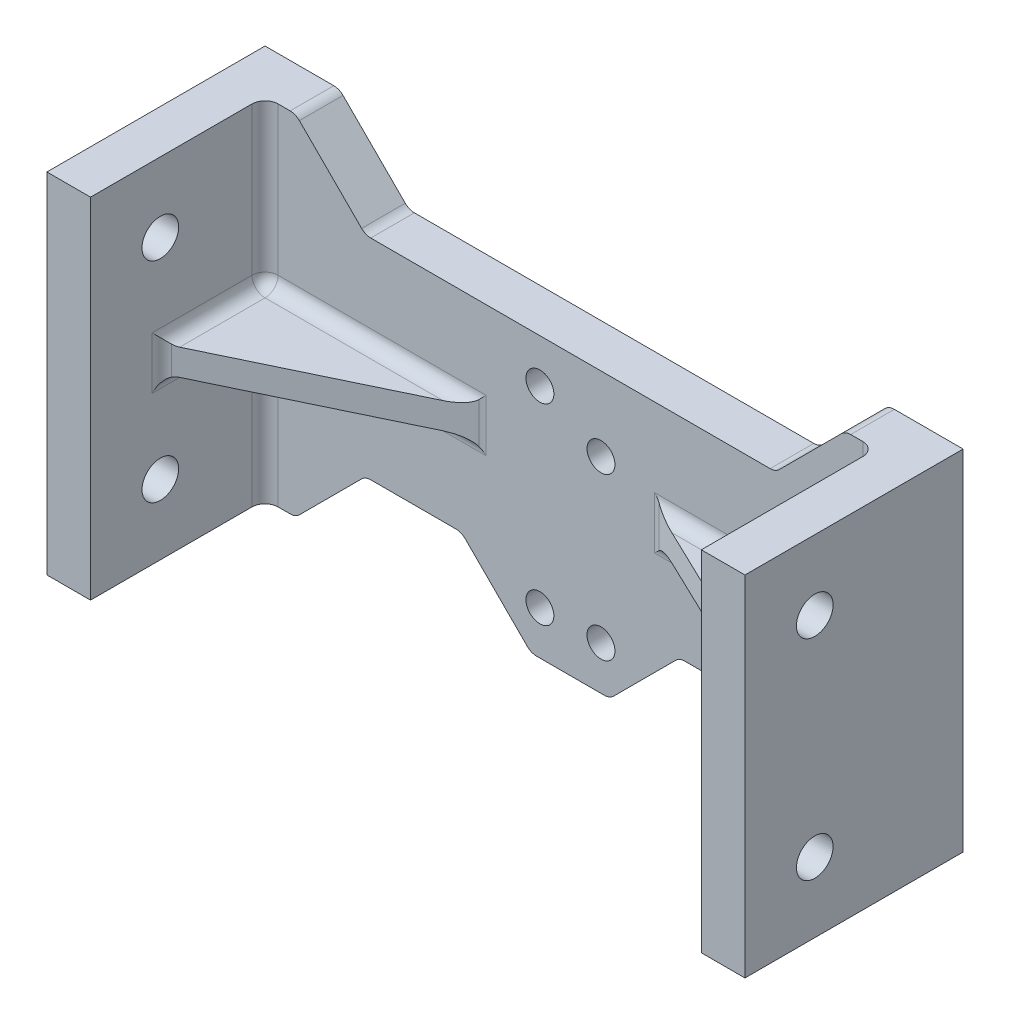
from build123d import *

# Parameters (mm, degrees)
EXTRUDE_1_DEPTH     = 40
FILLET_1_R          = 1.5
SKETCH_3_R          = 1.6
CUT_EXTRUDE_1_DEPTH = 40
SKETCH_4_R          = 2.1
CUT_EXTRUDE_2_DEPTH = 80
SKETCH_5_R          = 1.6
CUT_EXTRUDE_3_DEPTH = 80
CUT_EXTRUDE_4_DEPTH = 10
FILLET_4_R          = 1.5
EXTRUDE_2_DEPTH     = 1.5
FILLET_5_R          = 1.5
FILLET_6_R          = 1.5


with BuildPart() as part:
    # 草图2 → 凸台-拉伸1 (new body)
    with BuildSketch(Plane(origin=(0, 4.726404994, 0), x_dir=(1, 0, 0), z_dir=(0, 1, 0))):
        Polygon((21, 0), (-59, 0), (-59, -25), (-54, -25), (-54, -5), (16, -5), (16, -25), (21, -25), align=None)
    extrude(amount=-EXTRUDE_1_DEPTH)

    # 圆角1
    fillet_1_edges = [part.edges().sort_by_distance(p)[0] for p in [
        (16, -15.273595006, 5),
        (-54, -15.273595006, 5),
    ]]
    fillet(fillet_1_edges, radius=FILLET_1_R)

    # 草图3 → 切除-拉伸1 (cut)
    with BuildSketch(Plane.XY.offset(5)):
        with Locations((-22.5, -30.273595006)):
            Circle(SKETCH_3_R)
        with Locations((-22.5, -8.273595006)):
            Circle(SKETCH_3_R)
    extrude(amount=-CUT_EXTRUDE_1_DEPTH, mode=Mode.SUBTRACT)

    # 草图4 → 切除-拉伸2 (cut)
    with BuildSketch(Plane.ZY.offset(59)):
        with Locations(Location((17, -3.273595006, 0), (0, 0, 270))):
            Circle(SKETCH_4_R)
        with Locations(Location((17, -27.273595006, 0), (0, 0, 270))):
            Circle(SKETCH_4_R)
    extrude(amount=-CUT_EXTRUDE_2_DEPTH, mode=Mode.SUBTRACT)

    # 草图5 → 切除-拉伸3 (cut)
    with BuildSketch(Plane.XY.offset(5)):
        with Locations((-15.5, -30.273595006)):
            Circle(SKETCH_5_R)
        with Locations((-15.5, -11.773595006)):
            Circle(SKETCH_5_R)
    extrude(amount=-CUT_EXTRUDE_3_DEPTH, mode=Mode.SUBTRACT)

    # 草图7 → 切除-拉伸4 (cut)
    with BuildSketch(Plane.XY.offset(5)):
        with BuildLine():
            Line((-50.5, 4.726404994), (-42.933047922, -2.840547084))
            ThreePointArc((-42.933047922, -2.840547084), (-42.453382132, -3.161049518), (-41.887577755, -3.273595006))
            Line((-41.887577755, -3.273595006), (3.887577755, -3.273595006))
            ThreePointArc((3.887577755, -3.273595006), (4.453382132, -3.161049518), (4.933047922, -2.840547084))
            Line((4.933047922, -2.840547084), (12.5, 4.726404994))
            Line((12.5, 4.726404994), (-50.5, 4.726404994))
        make_face()
        with BuildLine():
            Line((12.5, -35.273595006), (-14.5, -35.273595006))
            Line((-14.5, -35.273595006), (-6.939339828, -27.712934835))
            ThreePointArc((-6.939339828, -27.712934835), (-6.452704805, -27.387775708), (-5.878679656, -27.273595006))
            Line((-5.878679656, -27.273595006), (3.887577755, -27.273595006))
            ThreePointArc((3.887577755, -27.273595006), (4.453382132, -27.386140495), (4.933047922, -27.706642929))
            Line((4.933047922, -27.706642929), (12.5, -35.273595006))
        make_face()
        with BuildLine():
            Line((-41.887577755, -27.273595006), (-32.121320344, -27.273595006))
            ThreePointArc((-32.121320344, -27.273595006), (-31.547295195, -27.387775708), (-31.060660172, -27.712934835))
            Line((-31.060660172, -27.712934835), (-23.5, -35.273595006))
            Line((-23.5, -35.273595006), (-50.5, -35.273595006))
            Line((-50.5, -35.273595006), (-42.933047922, -27.706642929))
            ThreePointArc((-42.933047922, -27.706642929), (-42.453382132, -27.386140495), (-41.887577755, -27.273595006))
        make_face()
    extrude(amount=-CUT_EXTRUDE_4_DEPTH, mode=Mode.SUBTRACT)

    # 圆角4
    fillet_4_edges = [part.edges().sort_by_distance(p)[0] for p in [
        (-50.5, 4.726404994, 2.5),
        (12.5, 4.726404994, 2.5),
        (-14.5, -35.273595006, 2.5),
        (12.5, -35.273595006, 2.5),
        (-50.5, -35.273595006, 2.5),
        (-23.5, -35.273595006, 2.5),
    ]]
    fillet(fillet_4_edges, radius=FILLET_4_R)

    # 草图6 → 凸台-拉伸2 (add, symmetric)
    with BuildSketch(Plane(origin=(0, -15.273595006, 0), x_dir=(-1, 0, 0), z_dir=(0, -1, 0))):
        Polygon((-16, -17), (9, -5), (-16, -5), align=None)
    extrude_2 = extrude(amount=EXTRUDE_2_DEPTH, both=True)

    # 圆角5
    fillet_5_edges = [part.edges().sort_by_distance(p)[0] for p in [
        (15.560660172, -16.773595006, 5.439339828),
        (15.560660172, -13.773595006, 5.439339828),
        (2.75, -13.773595006, 5),
        (2.75, -16.773595006, 5),
        (16, -16.773595006, 11.75),
        (16, -13.773595006, 11.75),
        (16, -15.273595006, 17),
        (-9, -15.273595006, 5),
    ]]
    fillet(fillet_5_edges, radius=FILLET_5_R)

    # 镜向2: 凸台-拉伸2 across plane
    add(extrude_2.mirror(Plane.ZY.offset(19)))

    # 圆角6
    fillet_6_edges = [part.edges().sort_by_distance(p)[0] for p in [
        (-53.560660172, -16.773595006, 5.439339828),
        (-53.560660172, -13.773595006, 5.439339828),
        (-40.75, -16.773595006, 5),
        (-29, -15.273595006, 5),
        (-54, -13.773595006, 11.75),
        (-40.75, -13.773595006, 5),
        (-54, -16.773595006, 11.75),
        (-54, -15.273595006, 17),
    ]]
    fillet(fillet_6_edges, radius=FILLET_6_R)


solid = part.part
